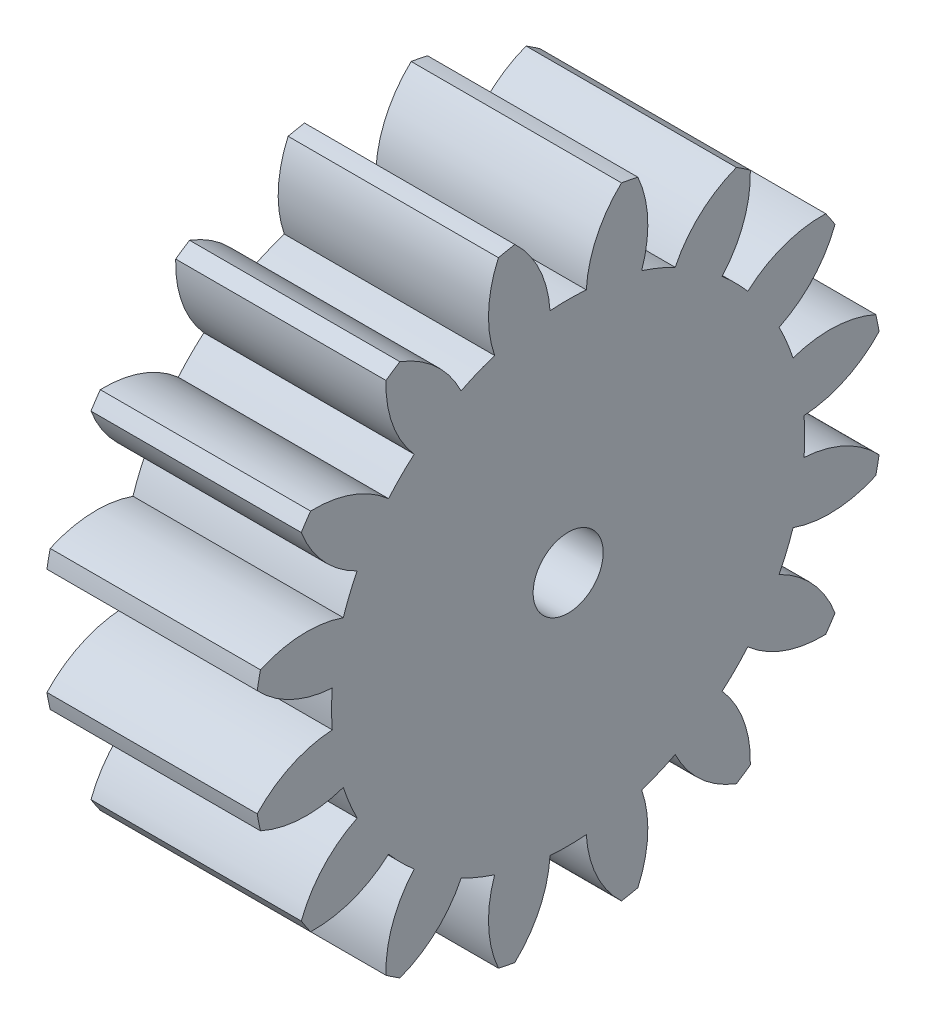
from build123d import *

# Parameters (mm, degrees)
BASPROSKE_W     = 12
BASPROSKE_H     = 18
TOOTHCUT_DEPTH  = 29.142494559
TEETHCUTS_COUNT = 16
TEETHCUTS_ANGLE = 337.5
BORSKE_R        = 2
BORE_DEPTH      = 50.0000508


with BuildPart() as part:
    # BasProSke → Base-Revolve (revolve)
    with BuildSketch(Plane(origin=(0, 0, 0), x_dir=(1, 0, 0), z_dir=(0, 1, 0)), mode=Mode.PRIVATE) as base_revolve_sk:
        with Locations((6, 9)):
            Rectangle(BASPROSKE_W, BASPROSKE_H)
    revolve(base_revolve_sk.sketch.rotate(Axis((-10, 0, 0), (1, 0, 0)), 180), axis=Axis((-10, 0, 0), (1, 0, 0)))

    # TooCutSke → ToothCut (cut, through all)
    with BuildSketch(Plane(origin=(0, 0, 0), x_dir=(0, 0, -1), z_dir=(1, 0, 0))):
        with BuildLine():
            ThreePointArc((1.03434411, 13.459313997), (0, 13.499), (-1.03434411, 13.459313997))
            ThreePointArc((-1.03434411, 13.459313997), (-1.635143665, 15.806872195), (-3.065655864, 17.762792553))
            ThreePointArc((-3.065655864, 17.762792553), (0, 18.0254), (3.065655864, 17.762792553))
            ThreePointArc((3.065655864, 17.762792553), (1.635143665, 15.806872195), (1.03434411, 13.459313997))
        make_face()
    toothcut = extrude(amount=TOOTHCUT_DEPTH, mode=Mode.SUBTRACT)

    # TeethCuts: ToothCut ×16 about axis
    teethcuts_axis = Axis((-10, 0, 0), (1, 0, 0))
    for i in range(1, TEETHCUTS_COUNT):
        add(toothcut.rotate(teethcuts_axis, i * TEETHCUTS_ANGLE / (TEETHCUTS_COUNT - 1)), mode=Mode.SUBTRACT)

    # BorSke → Bore (cut, symmetric)
    with BuildSketch(Plane(origin=(0, 0, 0), x_dir=(0, 0, -1), z_dir=(1, 0, 0))):
        with Locations(Location((0, 0, 0), (0, 0, 180))):
            Circle(BORSKE_R)
    extrude(amount=BORE_DEPTH, both=True, mode=Mode.SUBTRACT)


solid = part.part
